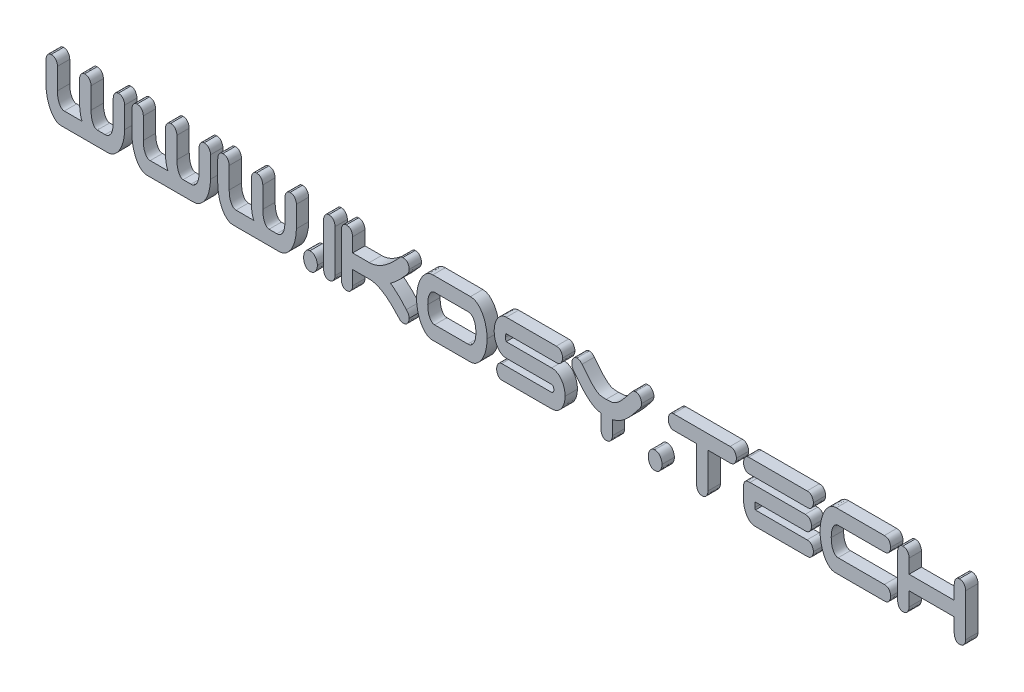
from build123d import *

# Parameters (mm, degrees)
TEXT_EXTRUDE_DEPTH    = 2.5
TEXT_EXTRUDE_2_DEPTH  = 2.5
TEXT_EXTRUDE_3_DEPTH  = 2.5
TEXT_EXTRUDE_4_DEPTH  = 2.5
TEXT_EXTRUDE_5_DEPTH  = 2.5
TEXT_EXTRUDE_6_DEPTH  = 2.5
TEXT_EXTRUDE_7_DEPTH  = 2.5
TEXT_EXTRUDE_8_DEPTH  = 2.5
TEXT_EXTRUDE_9_DEPTH  = 2.5
TEXT_EXTRUDE_10_DEPTH = 2.5
TEXT_EXTRUDE_11_DEPTH = 2.5
TEXT_EXTRUDE_12_DEPTH = 2.5
TEXT_EXTRUDE_13_DEPTH = 2.5
TEXT_EXTRUDE_14_DEPTH = 2.5
TEXT_EXTRUDE_15_DEPTH = 2.5


with BuildPart() as part:
    # Text Sketch → Text Extrude (new body)
    with BuildSketch(Plane.XY):
        with BuildLine():
            add(Edge.make_bspline(
                [(-1.665262476, 9.391283215), (-1.661647435, 9.485939531), (-1.654644135, 9.66931408), (-1.601170871, 9.935788598), (-1.511482213, 10.183634344), (-1.387210661, 10.408902666), (-1.233121899, 10.598793883), (-1.054153918, 10.744631077), (-0.846322218, 10.830852986), (-0.699610858, 10.840002964), (-0.625567077, 10.844620868)],
                knots=[0, 0, 0, 0, 1.147004837, 2.222054497, 3.279664014, 4.331359947, 5.326320678, 6.227132309, 7.105251108, 8, 8, 8, 8], degree=3))
            add(Edge.make_bspline(
                [(-0.625567077, 10.844620868), (-0.52186522, 10.839229926), (-0.325346259, 10.829013884), (-0.049586795, 10.743113534), (0.17785693, 10.588397932), (0.351477364, 10.378612786), (0.480291729, 10.142537388), (0.57961037, 9.897779928), (0.642628094, 9.646609051), (0.649303907, 9.476101408), (0.652624757, 9.391283215)],
                knots=[0, 0, 0, 0, 1.145886374, 2.171498243, 3.151055978, 4.145252637, 5.154343752, 6.11639408, 7.063009444, 8, 8, 8, 8], degree=3))
            Line((0.652624757, 9.391283215), (0.652624757, 5.094620868))
            add(Edge.make_bspline(
                [(0.652624757, 5.094620868), (0.656998695, 4.930565458), (0.665998508, 4.593005117), (0.714729293, 4.085918727), (0.812383062, 3.587666998), (0.977443244, 3.137755853), (1.186044372, 2.761989202), (1.391615293, 2.507933398), (1.580789619, 2.370982482), (1.726577249, 2.299037775), (1.883761548, 2.256535388), (1.991428748, 2.2505978), (2.046338302, 2.247569669)],
                knots=[0, 0, 0, 0, 1.421369808, 2.924609886, 4.408157366, 5.807360525, 7.05526964, 8.123192616, 8.601024659, 9.067825495, 9.524597215, 10, 10, 10, 10], degree=3))
            Line((2.046338302, 2.247569669), (5.679682437, 2.247569669))
            add(Edge.make_bspline(
                [(5.679682437, 2.247569669), (5.636776385, 2.326177759), (5.545400142, 2.493587989), (5.441102799, 2.780216742), (5.347133195, 3.108622744), (5.251720747, 3.610754297), (5.165854345, 4.276960032), (5.15317026, 4.82103053), (5.146791964, 5.094620868)],
                knots=[0, 0, 0, 0, 0.550596351, 1.172595107, 1.872108015, 2.651894347, 4.316377452, 6, 6, 6, 6], degree=3))
            Line((5.146791964, 5.094620868), (5.146791964, 9.391283215))
            add(Edge.make_bspline(
                [(5.146791964, 9.391283215), (5.150407005, 9.485939531), (5.157410304, 9.66931408), (5.210883568, 9.935788598), (5.300572226, 10.183634344), (5.424843778, 10.408902666), (5.578932541, 10.598793883), (5.757900522, 10.744631077), (5.965732221, 10.830852986), (6.112443581, 10.840002964), (6.186487362, 10.844620868)],
                knots=[0, 0, 0, 0, 1.147004837, 2.222054497, 3.279664014, 4.331359947, 5.326320678, 6.227132309, 7.105251108, 8, 8, 8, 8], degree=3))
            add(Edge.make_bspline(
                [(6.186487362, 10.844620868), (6.288940978, 10.839123102), (6.484202286, 10.828645179), (6.758664879, 10.743072245), (6.986457532, 10.588553077), (7.159155664, 10.377536732), (7.293069559, 10.143654548), (7.391420368, 9.897640172), (7.454742512, 9.646643342), (7.461378271, 9.476112799), (7.464679196, 9.391283215)],
                knots=[0, 0, 0, 0, 1.133181501, 2.159674891, 3.140074562, 4.13512574, 5.151897891, 6.114775108, 7.062204094, 8, 8, 8, 8], degree=3))
            Line((7.464679196, 9.391283215), (7.464679196, 5.094620868))
            add(Edge.make_bspline(
                [(7.464679196, 5.094620868), (7.468969063, 4.931807686), (7.477732809, 4.599197491), (7.527176411, 4.099719318), (7.624934527, 3.606174848), (7.753528095, 3.216299997), (7.883740738, 2.933990271), (7.987082153, 2.751801097), (8.095831978, 2.596067703), (8.210563624, 2.467498195), (8.33422143, 2.369076319), (8.464377704, 2.299914121), (8.599855687, 2.257093627), (8.692892003, 2.250732213), (8.739144524, 2.247569669)],
                knots=[0, 0, 0, 0, 1.738006205, 3.550563757, 5.349787416, 7.098028101, 7.916568963, 8.664770571, 9.330559333, 9.940551626, 10.497527359, 11.007556249, 11.506611747, 12, 12, 12, 12], degree=3))
            Line((8.739144524, 2.247569669), (10.326636423, 2.247569669))
            add(Edge.make_bspline(
                [(10.326636423, 2.247569669), (10.403864587, 2.251566188), (10.552470375, 2.259256464), (10.765943266, 2.306390209), (10.954592772, 2.394279474), (11.178150675, 2.553487774), (11.412283373, 2.819497989), (11.633085656, 3.20340022), (11.795835463, 3.650047313), (11.890834764, 4.138402447), (11.945653063, 4.625053437), (11.954619951, 4.944196168), (11.958846403, 5.094620868)],
                knots=[0, 0, 0, 0, 0.636428735, 1.224643805, 1.787762638, 2.338474794, 3.475490099, 4.672300096, 5.970444146, 7.371112152, 8.760900289, 10, 10, 10, 10], degree=3))
            Line((11.958846403, 5.094620868), (11.958846403, 9.391283215))
            add(Edge.make_bspline(
                [(11.958846403, 9.391283215), (11.962461444, 9.485939531), (11.969464744, 9.66931408), (12.022938008, 9.935788598), (12.112626666, 10.183634344), (12.236898218, 10.408902666), (12.39098698, 10.598793883), (12.569954961, 10.744631077), (12.777786661, 10.830852986), (12.924498021, 10.840002964), (12.998541802, 10.844620868)],
                knots=[0, 0, 0, 0, 1.147004837, 2.222054497, 3.279664014, 4.331359947, 5.326320678, 6.227132309, 7.105251108, 8, 8, 8, 8], degree=3))
            add(Edge.make_bspline(
                [(12.998541802, 10.844620868), (13.100995418, 10.839123102), (13.296256725, 10.828645179), (13.570719319, 10.743072245), (13.798511971, 10.588553077), (13.971210104, 10.377536732), (14.105123998, 10.143654548), (14.203474807, 9.897640172), (14.266796951, 9.646643342), (14.27343271, 9.476112799), (14.276733636, 9.391283215)],
                knots=[0, 0, 0, 0, 1.133181501, 2.159674891, 3.140074562, 4.13512574, 5.151897891, 6.114775108, 7.062204094, 8, 8, 8, 8], degree=3))
            Line((14.276733636, 9.391283215), (14.276733636, 5.094620868))
            add(Edge.make_bspline(
                [(14.276733636, 5.094620868), (14.266489461, 4.776023552), (14.245597171, 4.12626621), (14.10735497, 3.319576423), (13.950601674, 2.680075667), (13.810260799, 2.214466993), (13.638495715, 1.773328366), (13.444095749, 1.353366717), (13.226593876, 0.956137232), (12.970625915, 0.58874133), (12.68195493, 0.248538348), (12.366680531, -0.063304026), (12.016603739, -0.333071535), (11.618554403, -0.518825502), (11.184188863, -0.636262779), (10.881430091, -0.648877075), (10.725372651, -0.655379132)],
                knots=[0, 0, 0, 0, 1.799801224, 3.670570972, 4.610410242, 5.520845599, 6.416464605, 7.283311826, 8.134931654, 8.972283627, 9.809105761, 10.653023461, 11.475770373, 12.292173682, 13.11969849, 14, 14, 14, 14], degree=3))
            Line((10.725372651, -0.655379132), (1.479909268, -0.655379132))
            add(Edge.make_bspline(
                [(1.479909268, -0.655379132), (1.352381775, -0.649647021), (1.101506324, -0.638370663), (0.74022145, -0.526787342), (0.4037058, -0.355231111), (0.100696514, -0.109185752), (-0.174017253, 0.18476473), (-0.428519065, 0.515145564), (-0.660617761, 0.879115796), (-0.868605307, 1.276951083), (-1.047671473, 1.706659083), (-1.213373991, 2.155605612), (-1.350319514, 2.628043679), (-1.502744938, 3.278825565), (-1.632617582, 4.103395361), (-1.654486484, 4.76741999), (-1.665262476, 5.094620868)],
                knots=[0, 0, 0, 0, 0.74818093, 1.47184129, 2.203863704, 2.958156395, 3.754085872, 4.566677148, 5.407838898, 6.290259488, 7.203628613, 8.144381123, 9.103901089, 10.094628626, 12.075612124, 14, 14, 14, 14], degree=3))
            Line((-1.665262476, 5.094620868), (-1.665262476, 9.391283215))
        make_face()
    extrude(amount=TEXT_EXTRUDE_DEPTH)


with BuildPart() as body_2:
    # Text Sketch → Text Extrude 2 (new body)
    with BuildSketch(Plane.XY):
        with BuildLine():
            add(Edge.make_bspline(
                [(15.744977317, 9.391283215), (15.748592358, 9.485939531), (15.755595657, 9.66931408), (15.809068922, 9.935788598), (15.89875758, 10.183634344), (16.023029132, 10.408902666), (16.177117894, 10.598793883), (16.356085875, 10.744631077), (16.563917575, 10.830852986), (16.710628935, 10.840002964), (16.784672715, 10.844620868)],
                knots=[0, 0, 0, 0, 1.147004837, 2.222054497, 3.279664014, 4.331359947, 5.326320678, 6.227132309, 7.105251108, 8, 8, 8, 8], degree=3))
            add(Edge.make_bspline(
                [(16.784672715, 10.844620868), (16.888374572, 10.839229926), (17.084893533, 10.829013884), (17.360652998, 10.743113534), (17.588096723, 10.588397932), (17.761717156, 10.378612786), (17.890531521, 10.142537388), (17.989850162, 9.897779928), (18.052867887, 9.646609051), (18.059543699, 9.476101408), (18.06286455, 9.391283215)],
                knots=[0, 0, 0, 0, 1.145886374, 2.171498243, 3.151055978, 4.145252637, 5.154343752, 6.11639408, 7.063009444, 8, 8, 8, 8], degree=3))
            Line((18.06286455, 9.391283215), (18.06286455, 5.094620868))
            add(Edge.make_bspline(
                [(18.06286455, 5.094620868), (18.067238487, 4.930565458), (18.0762383, 4.593005117), (18.124969085, 4.085918727), (18.222622855, 3.587666998), (18.387683036, 3.137755853), (18.596284164, 2.761989202), (18.801855085, 2.507933398), (18.991029411, 2.370982482), (19.136817041, 2.299037775), (19.29400134, 2.256535388), (19.40166854, 2.2505978), (19.456578095, 2.247569669)],
                knots=[0, 0, 0, 0, 1.421369808, 2.924609886, 4.408157366, 5.807360525, 7.05526964, 8.123192616, 8.601024659, 9.067825495, 9.524597215, 10, 10, 10, 10], degree=3))
            Line((19.456578095, 2.247569669), (23.089922229, 2.247569669))
            add(Edge.make_bspline(
                [(23.089922229, 2.247569669), (23.047016178, 2.326177759), (22.955639934, 2.493587989), (22.851342591, 2.780216742), (22.757372988, 3.108622744), (22.66196054, 3.610754297), (22.576094138, 4.276960032), (22.563410053, 4.82103053), (22.557031756, 5.094620868)],
                knots=[0, 0, 0, 0, 0.550596351, 1.172595107, 1.872108015, 2.651894347, 4.316377452, 6, 6, 6, 6], degree=3))
            Line((22.557031756, 5.094620868), (22.557031756, 9.391283215))
            add(Edge.make_bspline(
                [(22.557031756, 9.391283215), (22.560646797, 9.485939531), (22.567650097, 9.66931408), (22.621123361, 9.935788598), (22.710812019, 10.183634344), (22.835083571, 10.408902666), (22.989172333, 10.598793883), (23.168140314, 10.744631077), (23.375972014, 10.830852986), (23.522683374, 10.840002964), (23.596727155, 10.844620868)],
                knots=[0, 0, 0, 0, 1.147004837, 2.222054497, 3.279664014, 4.331359947, 5.326320678, 6.227132309, 7.105251108, 8, 8, 8, 8], degree=3))
            add(Edge.make_bspline(
                [(23.596727155, 10.844620868), (23.699180771, 10.839123102), (23.894442078, 10.828645179), (24.168904672, 10.743072245), (24.396697324, 10.588553077), (24.569395457, 10.377536732), (24.703309351, 10.143654548), (24.801660161, 9.897640172), (24.864982304, 9.646643342), (24.871618063, 9.476112799), (24.874918989, 9.391283215)],
                knots=[0, 0, 0, 0, 1.133181501, 2.159674891, 3.140074562, 4.13512574, 5.151897891, 6.114775108, 7.062204094, 8, 8, 8, 8], degree=3))
            Line((24.874918989, 9.391283215), (24.874918989, 5.094620868))
            add(Edge.make_bspline(
                [(24.874918989, 5.094620868), (24.879208856, 4.931807686), (24.887972601, 4.599197491), (24.937416204, 4.099719318), (25.035174319, 3.606174848), (25.163767888, 3.216299997), (25.293980531, 2.933990271), (25.397321946, 2.751801097), (25.50607177, 2.596067703), (25.620803417, 2.467498195), (25.744461222, 2.369076319), (25.874617496, 2.299914121), (26.010095479, 2.257093627), (26.103131795, 2.250732213), (26.149384316, 2.247569669)],
                knots=[0, 0, 0, 0, 1.738006205, 3.550563757, 5.349787416, 7.098028101, 7.916568963, 8.664770571, 9.330559333, 9.940551626, 10.497527359, 11.007556249, 11.506611747, 12, 12, 12, 12], degree=3))
            Line((26.149384316, 2.247569669), (27.736876215, 2.247569669))
            add(Edge.make_bspline(
                [(27.736876215, 2.247569669), (27.81410438, 2.251566188), (27.962710167, 2.259256464), (28.176183058, 2.306390209), (28.364832565, 2.394279474), (28.588390468, 2.553487774), (28.822523165, 2.819497989), (29.043325448, 3.20340022), (29.206075256, 3.650047313), (29.301074557, 4.138402447), (29.355892855, 4.625053437), (29.364859744, 4.944196168), (29.369086196, 5.094620868)],
                knots=[0, 0, 0, 0, 0.636428735, 1.224643805, 1.787762638, 2.338474794, 3.475490099, 4.672300096, 5.970444146, 7.371112152, 8.760900289, 10, 10, 10, 10], degree=3))
            Line((29.369086196, 5.094620868), (29.369086196, 9.391283215))
            add(Edge.make_bspline(
                [(29.369086196, 9.391283215), (29.372701237, 9.485939531), (29.379704536, 9.66931408), (29.4331778, 9.935788598), (29.522866458, 10.183634344), (29.64713801, 10.408902666), (29.801226773, 10.598793883), (29.980194754, 10.744631077), (30.188026453, 10.830852986), (30.334737813, 10.840002964), (30.408781594, 10.844620868)],
                knots=[0, 0, 0, 0, 1.147004837, 2.222054497, 3.279664014, 4.331359947, 5.326320678, 6.227132309, 7.105251108, 8, 8, 8, 8], degree=3))
            add(Edge.make_bspline(
                [(30.408781594, 10.844620868), (30.51123521, 10.839123102), (30.706496518, 10.828645179), (30.980959111, 10.743072245), (31.208751764, 10.588553077), (31.381449896, 10.377536732), (31.515363791, 10.143654548), (31.6137146, 9.897640172), (31.677036744, 9.646643342), (31.683672503, 9.476112799), (31.686973428, 9.391283215)],
                knots=[0, 0, 0, 0, 1.133181501, 2.159674891, 3.140074562, 4.13512574, 5.151897891, 6.114775108, 7.062204094, 8, 8, 8, 8], degree=3))
            Line((31.686973428, 9.391283215), (31.686973428, 5.094620868))
            add(Edge.make_bspline(
                [(31.686973428, 5.094620868), (31.676729254, 4.776023552), (31.655836964, 4.12626621), (31.517594762, 3.319576423), (31.360841467, 2.680075667), (31.220500592, 2.214466993), (31.048735508, 1.773328366), (30.854335542, 1.353366717), (30.636833669, 0.956137232), (30.380865708, 0.58874133), (30.092194723, 0.248538348), (29.776920324, -0.063304026), (29.426843532, -0.333071535), (29.028794196, -0.518825502), (28.594428656, -0.636262779), (28.291669884, -0.648877075), (28.135612443, -0.655379132)],
                knots=[0, 0, 0, 0, 1.799801224, 3.670570972, 4.610410242, 5.520845599, 6.416464605, 7.283311826, 8.134931654, 8.972283627, 9.809105761, 10.653023461, 11.475770373, 12.292173682, 13.11969849, 14, 14, 14, 14], degree=3))
            Line((28.135612443, -0.655379132), (18.89014906, -0.655379132))
            add(Edge.make_bspline(
                [(18.89014906, -0.655379132), (18.762621568, -0.649647021), (18.511746116, -0.638370663), (18.150461243, -0.526787342), (17.813945592, -0.355231111), (17.510936307, -0.109185752), (17.23622254, 0.18476473), (16.981720728, 0.515145564), (16.749622031, 0.879115796), (16.541634486, 1.276951083), (16.362568319, 1.706659083), (16.196865802, 2.155605612), (16.059920279, 2.628043679), (15.907494854, 3.278825565), (15.777622211, 4.103395361), (15.755753309, 4.76741999), (15.744977317, 5.094620868)],
                knots=[0, 0, 0, 0, 0.74818093, 1.47184129, 2.203863704, 2.958156395, 3.754085872, 4.566677148, 5.407838898, 6.290259488, 7.203628613, 8.144381123, 9.103901089, 10.094628626, 12.075612124, 14, 14, 14, 14], degree=3))
            Line((15.744977317, 5.094620868), (15.744977317, 9.391283215))
        make_face()
    extrude(amount=TEXT_EXTRUDE_2_DEPTH)


with BuildPart() as body_3:
    # Text Sketch → Text Extrude 3 (new body)
    with BuildSketch(Plane.XY):
        with BuildLine():
            add(Edge.make_bspline(
                [(33.15521711, 9.391283215), (33.158832151, 9.485939531), (33.16583545, 9.66931408), (33.219308714, 9.935788598), (33.308997372, 10.183634344), (33.433268924, 10.408902666), (33.587357687, 10.598793883), (33.766325667, 10.744631077), (33.974157367, 10.830852986), (34.120868727, 10.840002964), (34.194912508, 10.844620868)],
                knots=[0, 0, 0, 0, 1.147004837, 2.222054497, 3.279664014, 4.331359947, 5.326320678, 6.227132309, 7.105251108, 8, 8, 8, 8], degree=3))
            add(Edge.make_bspline(
                [(34.194912508, 10.844620868), (34.298614365, 10.839229926), (34.495133326, 10.829013884), (34.77089279, 10.743113534), (34.998336516, 10.588397932), (35.171956949, 10.378612786), (35.300771314, 10.142537388), (35.400089955, 9.897779928), (35.46310768, 9.646609051), (35.469783492, 9.476101408), (35.473104342, 9.391283215)],
                knots=[0, 0, 0, 0, 1.145886374, 2.171498243, 3.151055978, 4.145252637, 5.154343752, 6.11639408, 7.063009444, 8, 8, 8, 8], degree=3))
            Line((35.473104342, 9.391283215), (35.473104342, 5.094620868))
            add(Edge.make_bspline(
                [(35.473104342, 5.094620868), (35.47747828, 4.930565458), (35.486478093, 4.593005117), (35.535208878, 4.085918727), (35.632862647, 3.587666998), (35.797922829, 3.137755853), (36.006523957, 2.761989202), (36.212094878, 2.507933398), (36.401269204, 2.370982482), (36.547056834, 2.299037775), (36.704241133, 2.256535388), (36.811908333, 2.2505978), (36.866817887, 2.247569669)],
                knots=[0, 0, 0, 0, 1.421369808, 2.924609886, 4.408157366, 5.807360525, 7.05526964, 8.123192616, 8.601024659, 9.067825495, 9.524597215, 10, 10, 10, 10], degree=3))
            Line((36.866817887, 2.247569669), (40.500162022, 2.247569669))
            add(Edge.make_bspline(
                [(40.500162022, 2.247569669), (40.45725597, 2.326177759), (40.365879727, 2.493587989), (40.261582384, 2.780216742), (40.167612781, 3.108622744), (40.072200332, 3.610754297), (39.986333931, 4.276960032), (39.973649846, 4.82103053), (39.967271549, 5.094620868)],
                knots=[0, 0, 0, 0, 0.550596351, 1.172595107, 1.872108015, 2.651894347, 4.316377452, 6, 6, 6, 6], degree=3))
            Line((39.967271549, 5.094620868), (39.967271549, 9.391283215))
            add(Edge.make_bspline(
                [(39.967271549, 9.391283215), (39.97088659, 9.485939531), (39.977889889, 9.66931408), (40.031363154, 9.935788598), (40.121051812, 10.183634344), (40.245323364, 10.408902666), (40.399412126, 10.598793883), (40.578380107, 10.744631077), (40.786211807, 10.830852986), (40.932923167, 10.840002964), (41.006966948, 10.844620868)],
                knots=[0, 0, 0, 0, 1.147004837, 2.222054497, 3.279664014, 4.331359947, 5.326320678, 6.227132309, 7.105251108, 8, 8, 8, 8], degree=3))
            add(Edge.make_bspline(
                [(41.006966948, 10.844620868), (41.109420563, 10.839123102), (41.304681871, 10.828645179), (41.579144465, 10.743072245), (41.806937117, 10.588553077), (41.97963525, 10.377536732), (42.113549144, 10.143654548), (42.211899953, 9.897640172), (42.275222097, 9.646643342), (42.281857856, 9.476112799), (42.285158782, 9.391283215)],
                knots=[0, 0, 0, 0, 1.133181501, 2.159674891, 3.140074562, 4.13512574, 5.151897891, 6.114775108, 7.062204094, 8, 8, 8, 8], degree=3))
            Line((42.285158782, 9.391283215), (42.285158782, 5.094620868))
            add(Edge.make_bspline(
                [(42.285158782, 5.094620868), (42.289448648, 4.931807686), (42.298212394, 4.599197491), (42.347655996, 4.099719318), (42.445414112, 3.606174848), (42.57400768, 3.216299997), (42.704220324, 2.933990271), (42.807561739, 2.751801097), (42.916311563, 2.596067703), (43.031043209, 2.467498195), (43.154701015, 2.369076319), (43.284857289, 2.299914121), (43.420335272, 2.257093627), (43.513371588, 2.250732213), (43.559624109, 2.247569669)],
                knots=[0, 0, 0, 0, 1.738006205, 3.550563757, 5.349787416, 7.098028101, 7.916568963, 8.664770571, 9.330559333, 9.940551626, 10.497527359, 11.007556249, 11.506611747, 12, 12, 12, 12], degree=3))
            Line((43.559624109, 2.247569669), (45.147116008, 2.247569669))
            add(Edge.make_bspline(
                [(45.147116008, 2.247569669), (45.224344172, 2.251566188), (45.37294996, 2.259256464), (45.586422851, 2.306390209), (45.775072357, 2.394279474), (45.998630261, 2.553487774), (46.232762958, 2.819497989), (46.453565241, 3.20340022), (46.616315048, 3.650047313), (46.711314349, 4.138402447), (46.766132648, 4.625053437), (46.775099536, 4.944196168), (46.779325988, 5.094620868)],
                knots=[0, 0, 0, 0, 0.636428735, 1.224643805, 1.787762638, 2.338474794, 3.475490099, 4.672300096, 5.970444146, 7.371112152, 8.760900289, 10, 10, 10, 10], degree=3))
            Line((46.779325988, 5.094620868), (46.779325988, 9.391283215))
            add(Edge.make_bspline(
                [(46.779325988, 9.391283215), (46.782941029, 9.485939531), (46.789944329, 9.66931408), (46.843417593, 9.935788598), (46.933106251, 10.183634344), (47.057377803, 10.408902666), (47.211466565, 10.598793883), (47.390434546, 10.744631077), (47.598266246, 10.830852986), (47.744977606, 10.840002964), (47.819021387, 10.844620868)],
                knots=[0, 0, 0, 0, 1.147004837, 2.222054497, 3.279664014, 4.331359947, 5.326320678, 6.227132309, 7.105251108, 8, 8, 8, 8], degree=3))
            add(Edge.make_bspline(
                [(47.819021387, 10.844620868), (47.921475003, 10.839123102), (48.11673631, 10.828645179), (48.391198904, 10.743072245), (48.618991556, 10.588553077), (48.791689689, 10.377536732), (48.925603583, 10.143654548), (49.023954393, 9.897640172), (49.087276537, 9.646643342), (49.093912295, 9.476112799), (49.097213221, 9.391283215)],
                knots=[0, 0, 0, 0, 1.133181501, 2.159674891, 3.140074562, 4.13512574, 5.151897891, 6.114775108, 7.062204094, 8, 8, 8, 8], degree=3))
            Line((49.097213221, 9.391283215), (49.097213221, 5.094620868))
            add(Edge.make_bspline(
                [(49.097213221, 5.094620868), (49.086969046, 4.776023552), (49.066076756, 4.12626621), (48.927834555, 3.319576423), (48.771081259, 2.680075667), (48.630740384, 2.214466993), (48.4589753, 1.773328366), (48.264575334, 1.353366717), (48.047073461, 0.956137232), (47.791105501, 0.58874133), (47.502434515, 0.248538348), (47.187160116, -0.063304026), (46.837083324, -0.333071535), (46.439033988, -0.518825502), (46.004668449, -0.636262779), (45.701909677, -0.648877075), (45.545852236, -0.655379132)],
                knots=[0, 0, 0, 0, 1.799801224, 3.670570972, 4.610410242, 5.520845599, 6.416464605, 7.283311826, 8.134931654, 8.972283627, 9.809105761, 10.653023461, 11.475770373, 12.292173682, 13.11969849, 14, 14, 14, 14], degree=3))
            Line((45.545852236, -0.655379132), (36.300388853, -0.655379132))
            add(Edge.make_bspline(
                [(36.300388853, -0.655379132), (36.172861361, -0.649647021), (35.921985909, -0.638370663), (35.560701036, -0.526787342), (35.224185385, -0.355231111), (34.921176099, -0.109185752), (34.646462333, 0.18476473), (34.391960521, 0.515145564), (34.159861824, 0.879115796), (33.951874278, 1.276951083), (33.772808112, 1.706659083), (33.607105595, 2.155605612), (33.470160071, 2.628043679), (33.317734647, 3.278825565), (33.187862003, 4.103395361), (33.165993101, 4.76741999), (33.15521711, 5.094620868)],
                knots=[0, 0, 0, 0, 0.74818093, 1.47184129, 2.203863704, 2.958156395, 3.754085872, 4.566677148, 5.407838898, 6.290259488, 7.203628613, 8.144381123, 9.103901089, 10.094628626, 12.075612124, 14, 14, 14, 14], degree=3))
            Line((33.15521711, 5.094620868), (33.15521711, 9.391283215))
        make_face()
    extrude(amount=TEXT_EXTRUDE_3_DEPTH)


with BuildPart() as body_4:
    # Text Sketch → Text Extrude 4 (new body)
    with BuildSketch(Plane.XY):
        with BuildLine():
            add(Edge.make_bspline(
                [(50.565456902, 0.797958522), (50.569312687, 0.916360199), (50.576806847, 1.146487485), (50.647756566, 1.478210122), (50.753117191, 1.788479878), (50.909753402, 2.064018691), (51.094419429, 2.301104175), (51.316852984, 2.476485105), (51.570254788, 2.582930712), (51.749513453, 2.59533283), (51.839922229, 2.601587816)],
                knots=[0, 0, 0, 0, 1.160345278, 2.255264598, 3.315503269, 4.363336114, 5.351392794, 6.246249024, 7.115498931, 8, 8, 8, 8], degree=3))
            add(Edge.make_bspline(
                [(51.839922229, 2.601587816), (51.958673818, 2.594408069), (52.186319818, 2.580644542), (52.506464892, 2.476247077), (52.774175357, 2.288369954), (52.982065074, 2.034314334), (53.14582082, 1.747413874), (53.267624257, 1.44155068), (53.34069188, 1.123133089), (53.348818261, 0.906395225), (53.352883992, 0.797958522)],
                knots=[0, 0, 0, 0, 1.081536768, 2.073298739, 3.024956809, 4.020910659, 5.040460596, 6.026519013, 7.012642428, 8, 8, 8, 8], degree=3))
            add(Edge.make_bspline(
                [(53.352883992, 0.797958522), (53.348936746, 0.688258837), (53.341091777, 0.470235823), (53.266905037, 0.149659931), (53.146628748, -0.157940849), (52.983166191, -0.445618392), (52.772832421, -0.696241329), (52.506618415, -0.884190194), (52.186276638, -0.988416412), (51.958659015, -1.002204644), (51.839922229, -1.009397278)],
                knots=[0, 0, 0, 0, 0.997003298, 1.981497619, 2.976448412, 3.994314034, 4.980040474, 5.930126388, 6.92024995, 8, 8, 8, 8], degree=3))
            add(Edge.make_bspline(
                [(51.839922229, -1.009397278), (51.748081661, -1.003597829), (51.568356261, -0.992248725), (51.316911127, -0.881680696), (51.089734641, -0.714502548), (50.905870695, -0.476028838), (50.752924744, -0.198108513), (50.648228962, 0.112879045), (50.576483356, 0.446909235), (50.569215291, 0.678302653), (50.565456902, 0.797958522)],
                knots=[0, 0, 0, 0, 0.89426037, 1.750003366, 2.644842091, 3.630322595, 4.669537068, 5.738481425, 6.830545944, 8, 8, 8, 8], degree=3))
        make_face()
    extrude(amount=TEXT_EXTRUDE_4_DEPTH)


with BuildPart() as body_5:
    # Text Sketch → Text Extrude 5 (new body)
    with BuildSketch(Plane.XY):
        with BuildLine():
            add(Edge.make_bspline(
                [(56.937783539, 0.797958522), (56.934550232, 0.711887332), (56.928097497, 0.540114416), (56.864755808, 0.287752568), (56.765498541, 0.042907575), (56.636449469, -0.192821935), (56.464138103, -0.40334582), (56.234277508, -0.553155291), (55.959994368, -0.640041064), (55.763356374, -0.650081078), (55.659591704, -0.655379132)],
                knots=[0, 0, 0, 0, 0.94997657, 1.895875329, 2.857197367, 3.865524581, 4.858968616, 5.830145621, 6.854981083, 8, 8, 8, 8], degree=3))
            add(Edge.make_bspline(
                [(55.659591704, -0.655379132), (55.584235864, -0.65096414), (55.436140668, -0.642287454), (55.228530073, -0.554957019), (55.047289995, -0.413547378), (54.893797629, -0.224124829), (54.774495883, 0.00294414), (54.683112091, 0.25070549), (54.630951083, 0.518804417), (54.623643504, 0.703334661), (54.619896306, 0.797958522)],
                knots=[0, 0, 0, 0, 0.908202067, 1.784869782, 2.674971349, 3.668287915, 4.711008848, 5.766870674, 6.85489058, 8, 8, 8, 8], degree=3))
            Line((54.619896306, 0.797958522), (54.619896306, 9.391283215))
            add(Edge.make_bspline(
                [(54.619896306, 9.391283215), (54.623511347, 9.485939531), (54.630514646, 9.66931408), (54.683987911, 9.935788598), (54.773676569, 10.183634344), (54.897948121, 10.408902666), (55.052036883, 10.598793883), (55.231004864, 10.744631077), (55.438836564, 10.830852986), (55.585547924, 10.840002964), (55.659591704, 10.844620868)],
                knots=[0, 0, 0, 0, 1.147004837, 2.222054497, 3.279664014, 4.331359947, 5.326320678, 6.227132309, 7.105251108, 8, 8, 8, 8], degree=3))
            add(Edge.make_bspline(
                [(55.659591704, 10.844620868), (55.763293561, 10.839229926), (55.959812522, 10.829013884), (56.235571987, 10.743113534), (56.463015712, 10.588397932), (56.636636145, 10.378612786), (56.76545051, 10.142537388), (56.864769151, 9.897779928), (56.927786876, 9.646609051), (56.934462688, 9.476101408), (56.937783539, 9.391283215)],
                knots=[0, 0, 0, 0, 1.145886374, 2.171498243, 3.151055978, 4.145252637, 5.154343752, 6.11639408, 7.063009444, 8, 8, 8, 8], degree=3))
            Line((56.937783539, 9.391283215), (56.937783539, 0.797958522))
        make_face()
    extrude(amount=TEXT_EXTRUDE_5_DEPTH)


with BuildPart() as body_6:
    # Text Sketch → Text Extrude 6 (new body)
    with BuildSketch(Plane.XY):
        with BuildLine():
            Line((60.500324044, 6.547958522), (63.876539209, 6.547958522))
            add(Edge.make_bspline(
                [(63.876539209, 6.547958522), (64.013352764, 6.552945272), (64.28698551, 6.562918975), (64.696016283, 6.622526416), (65.100282877, 6.730008488), (65.643116703, 6.921863604), (66.314198562, 7.246784237), (67.089343862, 7.739597643), (67.843610376, 8.309325812), (68.557602178, 8.963991813), (69.256802628, 9.664613601), (69.710147851, 10.156148854), (69.939565781, 10.404893065)],
                knots=[0, 0, 0, 0, 0.555923698, 1.111870299, 1.674894669, 2.252652207, 3.448967243, 4.693708672, 5.979538165, 7.28373421, 8.625418241, 10, 10, 10, 10], degree=3))
            add(Edge.make_bspline(
                [(69.939565781, 10.404893065), (69.996719342, 10.472066453), (70.104108377, 10.598282302), (70.293452081, 10.73847091), (70.48836649, 10.829462813), (70.623129599, 10.839664959), (70.688593649, 10.844620868)],
                knots=[0, 0, 0, 0, 1.174655633, 2.207126415, 3.129073488, 4, 4, 4, 4], degree=3))
            add(Edge.make_bspline(
                [(70.688593649, 10.844620868), (70.792295506, 10.839229926), (70.988814467, 10.829013884), (71.264573931, 10.743113534), (71.492017656, 10.588397932), (71.66563809, 10.378612786), (71.794452455, 10.142537388), (71.893771096, 9.897779928), (71.95678882, 9.646609051), (71.963464633, 9.476101408), (71.966785483, 9.391283215)],
                knots=[0, 0, 0, 0, 1.145886374, 2.171498243, 3.151055978, 4.145252637, 5.154343752, 6.11639408, 7.063009444, 8, 8, 8, 8], degree=3))
            add(Edge.make_bspline(
                [(71.966785483, 9.391283215), (71.960175375, 9.277188886), (71.947353213, 9.055870886), (71.828481898, 8.738495446), (71.637309144, 8.437854134), (71.476319208, 8.24890582), (71.389176928, 8.146629942)],
                knots=[0, 0, 0, 0, 0.97070442, 1.882953905, 2.854063618, 4, 4, 4, 4], degree=3))
            add(Edge.make_bspline(
                [(71.389176928, 8.146629942), (71.250565867, 7.984704207), (70.982081064, 7.671059693), (70.585260096, 7.224458373), (70.203189805, 6.817375798), (69.817659662, 6.440945419), (69.403761963, 6.061801999), (69.030275663, 5.743197861), (68.717072193, 5.494553863), (68.505621514, 5.327015044), (68.316009093, 5.197674225), (68.197027473, 5.124073998), (68.143389501, 5.090894362)],
                knots=[0, 0, 0, 0, 1.429198024, 2.76830686, 4.00560822, 5.171790262, 6.380302347, 7.768852966, 8.462165869, 9.061913282, 9.577102168, 10, 10, 10, 10], degree=3))
            add(Edge.make_bspline(
                [(68.143389501, 5.090894362), (68.276777918, 5.006353533), (68.559734718, 4.827017106), (68.966501362, 4.495217289), (69.394827854, 4.133586095), (69.815944987, 3.740265787), (70.227245919, 3.347435173), (70.608165504, 2.933141627), (70.994281524, 2.500795805), (71.255378558, 2.200685644), (71.392903435, 2.042611795)],
                knots=[0, 0, 0, 0, 0.846905687, 1.796540712, 2.813290178, 3.8560258, 4.888565996, 5.86499491, 6.875451368, 8, 8, 8, 8], degree=3))
            add(Edge.make_bspline(
                [(71.392903435, 2.042611795), (71.479286362, 1.94312522), (71.641776613, 1.755986408), (71.826455931, 1.451973267), (71.947683325, 1.13357558), (71.960287666, 0.912122492), (71.966785483, 0.797958522)],
                knots=[0, 0, 0, 0, 1.124204507, 2.114680268, 3.028075944, 4, 4, 4, 4], degree=3))
            add(Edge.make_bspline(
                [(71.966785483, 0.797958522), (71.963552176, 0.711887332), (71.957099441, 0.540114416), (71.893757752, 0.287752568), (71.794500485, 0.042907575), (71.665451413, -0.192821935), (71.493140048, -0.40334582), (71.263279452, -0.553155291), (70.988996312, -0.640041064), (70.792358318, -0.650081078), (70.688593649, -0.655379132)],
                knots=[0, 0, 0, 0, 0.94997657, 1.895875329, 2.857197367, 3.865524581, 4.858968616, 5.830145621, 6.854981083, 8, 8, 8, 8], degree=3))
            add(Edge.make_bspline(
                [(70.688593649, -0.655379132), (70.621742518, -0.650807755), (70.486582523, -0.641565321), (70.293943004, -0.547657424), (70.104156674, -0.414498148), (69.998986248, -0.289368102), (69.943292288, -0.223104342)],
                knots=[0, 0, 0, 0, 0.894537412, 1.808580788, 2.839513922, 4, 4, 4, 4], degree=3))
            add(Edge.make_bspline(
                [(69.943292288, -0.223104342), (69.716363237, 0.024392428), (69.26325026, 0.51857331), (68.560029177, 1.226354593), (67.83951543, 1.891523697), (67.204121537, 2.378116986), (66.687201107, 2.72704405), (66.296809883, 2.957939804), (65.901076878, 3.159667356), (65.502265102, 3.332361249), (65.100167403, 3.470793367), (64.695473166, 3.572963959), (64.287153072, 3.635007937), (64.013387929, 3.641676343), (63.876539209, 3.645009721)],
                knots=[0, 0, 0, 0, 1.63305565, 3.260749131, 4.851847049, 6.398635549, 7.147663603, 7.884382876, 8.603119971, 9.306793234, 9.996529955, 10.669118359, 11.334723743, 12, 12, 12, 12], degree=3))
            Line((63.876539209, 3.645009721), (60.500324044, 3.645009721))
            Line((60.500324044, 3.645009721), (60.500324044, 0.797958522))
            add(Edge.make_bspline(
                [(60.500324044, 0.797958522), (60.497110576, 0.711876438), (60.490697433, 0.540081779), (60.427058175, 0.287883345), (60.328738407, 0.041825046), (60.194707244, -0.191880564), (60.023538588, -0.402196671), (59.797146592, -0.553243329), (59.528706012, -0.639254714), (59.337046012, -0.649850351), (59.237038237, -0.655379132)],
                knots=[0, 0, 0, 0, 0.956995596, 1.909883251, 2.878308143, 3.900938487, 4.901722713, 5.868565532, 6.887822087, 8, 8, 8, 8], degree=3))
            add(Edge.make_bspline(
                [(59.237038237, -0.655379132), (59.161682397, -0.65096414), (59.013587201, -0.642287454), (58.805976605, -0.554957019), (58.624736528, -0.413547378), (58.471244161, -0.224124829), (58.351942415, 0.00294414), (58.260558624, 0.25070549), (58.208397615, 0.518804417), (58.201090036, 0.703334661), (58.197342839, 0.797958522)],
                knots=[0, 0, 0, 0, 0.908202067, 1.784869782, 2.674971349, 3.668287915, 4.711008848, 5.766870674, 6.85489058, 8, 8, 8, 8], degree=3))
            Line((58.197342839, 0.797958522), (58.197342839, 9.391283215))
            add(Edge.make_bspline(
                [(58.197342839, 9.391283215), (58.200951795, 9.485944839), (58.207943306, 9.669329671), (58.261500291, 9.93573116), (58.350880695, 10.18384579), (58.475890186, 10.407448768), (58.625506826, 10.600160474), (58.803421469, 10.742235387), (59.005755918, 10.831670493), (59.14919169, 10.840255293), (59.22213221, 10.844620868)],
                knots=[0, 0, 0, 0, 1.154549111, 2.236669769, 3.301235575, 4.359848899, 5.351786401, 6.258523002, 7.114417303, 8, 8, 8, 8], degree=3))
            add(Edge.make_bspline(
                [(59.22213221, 10.844620868), (59.324585826, 10.839123102), (59.519847133, 10.828645179), (59.794309727, 10.743072245), (60.022102379, 10.588553077), (60.194800512, 10.377536732), (60.328714406, 10.143654548), (60.427065216, 9.897640172), (60.49038736, 9.646643342), (60.497023118, 9.476112799), (60.500324044, 9.391283215)],
                knots=[0, 0, 0, 0, 1.133181501, 2.159674891, 3.140074562, 4.13512574, 5.151897891, 6.114775108, 7.062204094, 8, 8, 8, 8], degree=3))
            Line((60.500324044, 9.391283215), (60.500324044, 6.547958522))
        make_face()
    extrude(amount=TEXT_EXTRUDE_6_DEPTH)


with BuildPart() as body_7:
    # Text Sketch → Text Extrude 7 (new body)
    with BuildSketch(Plane.XY):
        with BuildLine():
            add(Edge.make_bspline(
                [(87.767174336, 5.094620868), (87.756930161, 4.776023552), (87.736037871, 4.12626621), (87.59779567, 3.319576423), (87.441042374, 2.680075667), (87.300701499, 2.214466993), (87.128936415, 1.773328366), (86.934536449, 1.353366717), (86.717034576, 0.956137232), (86.461066615, 0.58874133), (86.17239563, 0.248538348), (85.857121231, -0.063304026), (85.507044439, -0.333071535), (85.108995103, -0.518825502), (84.674629563, -0.636262779), (84.371870791, -0.648877075), (84.215813351, -0.655379132)],
                knots=[0, 0, 0, 0, 1.799801224, 3.670570972, 4.610410242, 5.520845599, 6.416464605, 7.283311826, 8.134931654, 8.972283627, 9.809105761, 10.653023461, 11.475770373, 12.292173682, 13.11969849, 14, 14, 14, 14], degree=3))
            Line((84.215813351, -0.655379132), (76.595106935, -0.655379132))
            add(Edge.make_bspline(
                [(76.595106935, -0.655379132), (76.468544772, -0.640528847), (76.217101845, -0.611025566), (75.85996162, -0.477689644), (75.525367298, -0.289123584), (75.221790344, -0.035897363), (74.944421638, 0.262831556), (74.692827889, 0.59630973), (74.458115204, 0.955244851), (74.256062969, 1.347968886), (74.073540092, 1.765116418), (73.914224495, 2.204851714), (73.775671746, 2.665082269), (73.623533624, 3.302321121), (73.49317431, 4.114435098), (73.471736206, 4.769880754), (73.461114712, 5.094620868)],
                knots=[0, 0, 0, 0, 0.752995526, 1.495987393, 2.241274531, 3.021014421, 3.828493696, 4.653247209, 5.494759435, 6.367584086, 7.267779511, 8.192575619, 9.138386903, 10.115331307, 12.075343481, 14, 14, 14, 14], degree=3))
            add(Edge.make_bspline(
                [(73.461114712, 5.094620868), (73.470905906, 5.425692535), (73.490637982, 6.092897266), (73.631175858, 6.917729294), (73.785276694, 7.567695819), (73.93767825, 8.034668004), (74.101507309, 8.485806188), (74.301681659, 8.908288691), (74.516306703, 9.309536429), (74.769772249, 9.669434187), (75.038023965, 10.002645772), (75.333381057, 10.296581759), (75.654501392, 10.542209403), (76.005682068, 10.717233652), (76.379834315, 10.827060537), (76.639075332, 10.83872074), (76.770252754, 10.844620868)],
                knots=[0, 0, 0, 0, 1.918610406, 3.866552375, 4.837869682, 5.790063797, 6.713181678, 7.618709347, 8.498814124, 9.347956722, 10.166930783, 10.976763261, 11.758994285, 12.499873325, 13.24092741, 14, 14, 14, 14], degree=3))
            Line((76.770252754, 10.844620868), (84.398412184, 10.840894362))
            add(Edge.make_bspline(
                [(84.398412184, 10.840894362), (84.550964093, 10.823819883), (84.847867839, 10.790588723), (85.267446751, 10.65347681), (85.645075165, 10.448575735), (85.974739705, 10.176173964), (86.266617516, 9.861015829), (86.530700866, 9.520084089), (86.773783192, 9.158477927), (86.974999212, 8.763766236), (87.157400004, 8.350547979), (87.320368086, 7.916050503), (87.450708569, 7.457399882), (87.604315844, 6.829888837), (87.734015118, 6.040050569), (87.756264441, 5.405681835), (87.767174336, 5.094620868)],
                knots=[0, 0, 0, 0, 0.886158283, 1.724683192, 2.535023767, 3.357633345, 4.186246996, 5.015639229, 5.850708578, 6.702461068, 7.574344964, 8.463324812, 9.384257606, 10.330630737, 12.200734858, 14, 14, 14, 14], degree=3))
        make_face()
        with BuildLine():
            add(Edge.make_bspline(
                [(83.865521711, 2.247569669), (83.942775401, 2.251509172), (84.091430306, 2.259089735), (84.305671054, 2.307237359), (84.496470048, 2.393196263), (84.720643026, 2.553739022), (84.955007915, 2.81939294), (85.175394878, 3.203486885), (85.339586988, 3.649552177), (85.428442753, 4.13892095), (85.48482297, 4.624994544), (85.493596416, 4.944177302), (85.497731692, 5.094620868)],
                knots=[0, 0, 0, 0, 0.635967372, 1.223756031, 1.795771322, 2.346084253, 3.482275307, 4.678217707, 5.9754207, 7.373017898, 8.761798544, 10, 10, 10, 10], degree=3))
            add(Edge.make_bspline(
                [(85.497731692, 5.094620868), (85.493611897, 5.243829666), (85.484866946, 5.560550262), (85.42801312, 6.044004523), (85.339943952, 6.532486176), (85.173924731, 6.97849454), (84.957114754, 7.367728007), (84.715360939, 7.629694257), (84.494789633, 7.795518686), (84.304645752, 7.882609089), (84.091406658, 7.930052904), (83.942767314, 7.937698676), (83.865521711, 7.941672067)],
                knots=[0, 0, 0, 0, 1.228964797, 2.608683067, 4.007394366, 5.30563143, 6.511373666, 7.655401362, 8.212109266, 8.775268447, 9.363525664, 10, 10, 10, 10], degree=3))
            Line((83.865521711, 7.941672067), (77.120544394, 7.941672067))
            add(Edge.make_bspline(
                [(77.120544394, 7.941672067), (77.066918015, 7.938481781), (76.960578793, 7.932155554), (76.803614714, 7.890875717), (76.658473481, 7.814188686), (76.47229966, 7.673335424), (76.260869058, 7.423523678), (76.057851454, 7.045102046), (75.889172619, 6.597154817), (75.793244983, 6.10067879), (75.743693905, 5.595044353), (75.734864326, 5.258690505), (75.730557356, 5.094620868)],
                knots=[0, 0, 0, 0, 0.465574519, 0.923217892, 1.395730572, 1.880865226, 2.942702673, 4.202393103, 5.594156702, 7.080535221, 8.575917806, 10, 10, 10, 10], degree=3))
            add(Edge.make_bspline(
                [(75.730557356, 5.094620868), (75.734931429, 4.930565735), (75.743931521, 4.593005966), (75.792660132, 4.085915119), (75.890321995, 3.587679987), (76.055354689, 3.137712472), (76.26404241, 2.762123402), (76.469389153, 2.507607863), (76.658055246, 2.37213129), (76.801582198, 2.298159279), (76.958042337, 2.256688656), (77.065660068, 2.250649565), (77.120544394, 2.247569669)],
                knots=[0, 0, 0, 0, 1.42274262, 2.927434583, 4.412414928, 5.81296949, 7.062083882, 8.131038297, 8.609331849, 9.066925166, 9.524138053, 10, 10, 10, 10], degree=3))
            Line((77.120544394, 2.247569669), (83.865521711, 2.247569669))
        make_face(mode=Mode.SUBTRACT)
    extrude(amount=TEXT_EXTRUDE_7_DEPTH)


with BuildPart() as body_8:
    # Text Sketch → Text Extrude 8 (new body)
    with BuildSketch(Plane.XY):
        with BuildLine():
            add(Edge.make_bspline(
                [(91.661373947, 3.645009721), (91.571567661, 3.648255797), (91.395113952, 3.654633769), (91.137683897, 3.71551193), (90.889101497, 3.801667959), (90.658759643, 3.936061141), (90.442147115, 4.096968139), (90.240775256, 4.283094024), (90.058084854, 4.495391392), (89.824899528, 4.805937215), (89.585082893, 5.259022721), (89.365598779, 5.863758315), (89.224787547, 6.535454839), (89.209644102, 7.004379148), (89.201879456, 7.244815295)],
                knots=[0, 0, 0, 0, 0.670943409, 1.318286928, 1.971147206, 2.63301288, 3.304213849, 3.988358664, 4.680103576, 5.397785226, 6.891276586, 8.494040825, 10.202355266, 12, 12, 12, 12], degree=3))
            add(Edge.make_bspline(
                [(89.201879456, 7.244815295), (89.209467352, 7.485281873), (89.224189224, 7.951829942), (89.366053114, 8.619629687), (89.58627831, 9.221541506), (89.826401076, 9.674894554), (90.056659062, 9.991461498), (90.244776957, 10.201511409), (90.445688001, 10.389009342), (90.662376326, 10.550255708), (90.892802008, 10.682185145), (91.138876062, 10.776587502), (91.396636566, 10.833904994), (91.572894355, 10.841039447), (91.661373947, 10.844620868)],
                knots=[0, 0, 0, 0, 1.799259985, 3.490885429, 5.086350142, 6.589356348, 7.315176561, 8.013705268, 8.698464813, 9.370268881, 10.032729266, 10.680721254, 11.337735677, 12, 12, 12, 12], degree=3))
            Line((91.661373947, 10.844620868), (101.793745949, 10.844620868))
            add(Edge.make_bspline(
                [(101.793745949, 10.844620868), (101.897447806, 10.839229926), (102.093966767, 10.829013884), (102.369726232, 10.743113534), (102.597169957, 10.588397932), (102.77079039, 10.378612786), (102.899604755, 10.142537388), (102.998923396, 9.897779928), (103.061941121, 9.646609051), (103.068616933, 9.476101408), (103.071937784, 9.391283215)],
                knots=[0, 0, 0, 0, 1.145886374, 2.171498243, 3.151055978, 4.145252637, 5.154343752, 6.11639408, 7.063009444, 8, 8, 8, 8], degree=3))
            add(Edge.make_bspline(
                [(103.071937784, 9.391283215), (103.068617932, 9.306463546), (103.061944126, 9.135952938), (102.998911148, 8.884804598), (102.899652475, 8.639958538), (102.770603797, 8.404229327), (102.598292327, 8.193705363), (102.368431759, 8.043895913), (102.094148611, 7.957010134), (101.897510618, 7.946970121), (101.793745949, 7.941672067)],
                knots=[0, 0, 0, 0, 0.937886821, 1.885407656, 2.84837822, 3.858434566, 4.853582211, 5.826424641, 6.853017544, 8, 8, 8, 8], degree=3))
            Line((101.793745949, 7.941672067), (91.627835386, 7.941672067))
            add(Edge.make_bspline(
                [(91.627835386, 7.941672067), (91.635253936, 7.940113375), (91.653693207, 7.936239146), (91.64579516, 7.894129667), (91.619807004, 7.851951219), (91.574177234, 7.787070026), (91.522631926, 7.697512353), (91.493086578, 7.571646881), (91.475626456, 7.418056971), (91.472836528, 7.305767972), (91.4713221, 7.244815295)],
                knots=[0, 0, 0, 0, 0.215106107, 0.534659717, 1.070567413, 1.934692608, 3.024957124, 4.391259024, 6.041104441, 8, 8, 8, 8], degree=3))
            add(Edge.make_bspline(
                [(91.4713221, 7.244815295), (91.472240812, 7.1862702), (91.47393013, 7.078618025), (91.498448083, 6.930706292), (91.526934938, 6.806233906), (91.578051458, 6.713805042), (91.623937846, 6.645559692), (91.649497466, 6.599817808), (91.656870998, 6.556221608), (91.636930133, 6.550546746), (91.627835386, 6.547958522)],
                knots=[0, 0, 0, 0, 1.87810599, 3.453443801, 4.819040071, 5.944006706, 6.841177402, 7.412795962, 7.732184537, 8, 8, 8, 8], degree=3))
            Line((91.627835386, 6.547958522), (100.858392741, 6.547958522))
            add(Edge.make_bspline(
                [(100.858392741, 6.547958522), (100.965509985, 6.543434827), (101.176681151, 6.534516805), (101.485057101, 6.470592502), (101.775637638, 6.360373543), (102.045695432, 6.210621407), (102.295396315, 6.032324254), (102.517652387, 5.828696461), (102.722325879, 5.614515872), (102.951547142, 5.293293337), (103.19790109, 4.846421364), (103.407340222, 4.246851601), (103.551353422, 3.598253564), (103.567077445, 3.148924843), (103.575016202, 2.922067401)],
                knots=[0, 0, 0, 0, 0.767417958, 1.512889427, 2.245331768, 2.98632525, 3.720010713, 4.438581646, 5.144019774, 5.838419272, 7.260734989, 8.78409209, 10.376349862, 12, 12, 12, 12], degree=3))
            add(Edge.make_bspline(
                [(103.575016202, 2.922067401), (103.567198037, 2.695209264), (103.55179672, 2.248312307), (103.407755165, 1.604325116), (103.195168583, 1.009637245), (102.950715078, 0.560928669), (102.71411444, 0.243534926), (102.516460192, 0.025293382), (102.290914956, -0.169456604), (102.042267322, -0.339057654), (101.775368991, -0.485581544), (101.483778362, -0.57782008), (101.17847482, -0.648115791), (100.966904282, -0.652916775), (100.858392741, -0.655379132)],
                knots=[0, 0, 0, 0, 1.633240863, 3.217386786, 4.732905502, 6.175788295, 6.879607062, 7.583140963, 8.294100678, 9.021835744, 9.750836772, 10.478571838, 11.21968099, 12, 12, 12, 12], degree=3))
            Line((100.858392741, -0.655379132), (90.740926766, -0.655379132))
            add(Edge.make_bspline(
                [(90.740926766, -0.655379132), (90.666715338, -0.651074809), (90.520826997, -0.642613167), (90.316201206, -0.552747792), (90.132188546, -0.415249199), (89.979664993, -0.222858397), (89.854953079, 0.001743772), (89.764746662, 0.250881452), (89.712205681, 0.518757145), (89.704951291, 0.703318637), (89.701231367, 0.797958522)],
                knots=[0, 0, 0, 0, 0.894345496, 1.758146763, 2.661316177, 3.655828332, 4.707050109, 5.764182805, 6.853512289, 8, 8, 8, 8], degree=3))
            add(Edge.make_bspline(
                [(89.701231367, 0.797958522), (89.704829015, 0.892625502), (89.711798618, 1.076020707), (89.765511195, 1.342348524), (89.85395259, 1.589710365), (89.980638337, 1.812185248), (90.13330605, 2.003371094), (90.31495068, 2.145373661), (90.520966917, 2.234614681), (90.666762516, 2.243201613), (90.740926766, 2.247569669)],
                knots=[0, 0, 0, 0, 1.149184822, 2.22627771, 3.285897309, 4.326438727, 5.32329047, 6.2377172, 7.103550558, 8, 8, 8, 8], degree=3))
            Line((90.740926766, 2.247569669), (100.925469864, 2.247569669))
            add(Edge.make_bspline(
                [(100.925469864, 2.247569669), (100.968540841, 2.259030476), (101.073247736, 2.286892057), (101.191600255, 2.442063856), (101.291407374, 2.655085674), (101.300607583, 2.828476605), (101.305573558, 2.922067401)],
                knots=[0, 0, 0, 0, 0.628525303, 1.527964726, 2.665675604, 4, 4, 4, 4], degree=3))
            add(Edge.make_bspline(
                [(101.305573558, 2.922067401), (101.301538888, 3.022261353), (101.294119201, 3.206516249), (101.185102685, 3.42934075), (101.074270006, 3.599514175), (100.967479012, 3.632165452), (100.925469864, 3.645009721)],
                knots=[0, 0, 0, 0, 1.359030918, 2.499233701, 3.409632674, 4, 4, 4, 4], degree=3))
            Line((100.925469864, 3.645009721), (91.661373947, 3.645009721))
        make_face()
    extrude(amount=TEXT_EXTRUDE_8_DEPTH)


with BuildPart() as body_9:
    # Text Sketch → Text Extrude 9 (new body)
    with BuildSketch(Plane.XY):
        with BuildLine():
            add(Edge.make_bspline(
                [(113.170771225, 0.797958522), (113.167537918, 0.711887332), (113.161085184, 0.540114416), (113.097743494, 0.287752568), (112.998486228, 0.042907575), (112.869437155, -0.192821935), (112.69712579, -0.40334582), (112.467265194, -0.553155291), (112.192982054, -0.640041064), (111.99634406, -0.650081078), (111.892579391, -0.655379132)],
                knots=[0, 0, 0, 0, 0.94997657, 1.895875329, 2.857197367, 3.865524581, 4.858968616, 5.830145621, 6.854981083, 8, 8, 8, 8], degree=3))
            add(Edge.make_bspline(
                [(111.892579391, -0.655379132), (111.81722355, -0.65096414), (111.669128354, -0.642287454), (111.461517759, -0.554957019), (111.280277681, -0.413547378), (111.126785315, -0.224124829), (111.007483569, 0.00294414), (110.916099778, 0.25070549), (110.863938769, 0.518804417), (110.85663119, 0.703334661), (110.852883992, 0.797958522)],
                knots=[0, 0, 0, 0, 0.908202067, 1.784869782, 2.674971349, 3.668287915, 4.711008848, 5.766870674, 6.85489058, 8, 8, 8, 8], degree=3))
            Line((110.852883992, 0.797958522), (110.852883992, 3.645009721))
            add(Edge.make_bspline(
                [(110.852883992, 3.645009721), (110.773087678, 3.647510249), (110.605678932, 3.652756233), (110.344884615, 3.71311442), (110.059944465, 3.79233688), (109.75419775, 3.909109401), (109.434833728, 4.06164328), (109.106492902, 4.253224819), (108.770983832, 4.481855147), (108.428330353, 4.746373937), (108.080154607, 5.051515342), (107.724983243, 5.393837875), (107.358728467, 5.770898364), (106.983773152, 6.187696154), (106.597242638, 6.650253841), (106.181543796, 7.150999813), (105.751481616, 7.705141654), (105.456708407, 8.089347979), (105.30411536, 8.2882372)],
                knots=[0, 0, 0, 0, 0.51394259, 1.078226303, 1.720054327, 2.422657314, 3.18624554, 4.001425141, 4.872820343, 5.804218448, 6.792663798, 7.858349616, 8.986262296, 10.183677807, 11.474644071, 12.875408902, 14.382516238, 16, 16, 16, 16], degree=3))
            add(Edge.make_bspline(
                [(105.30411536, 8.2882372), (105.255196846, 8.364239388), (105.15450155, 8.52068451), (105.032675514, 8.782174619), (104.957688773, 9.077960513), (104.947734567, 9.285269734), (104.9426442, 9.391283215)],
                knots=[0, 0, 0, 0, 0.919132931, 1.89197004, 2.921998782, 4, 4, 4, 4], degree=3))
            add(Edge.make_bspline(
                [(104.9426442, 9.391283215), (104.946259241, 9.485939531), (104.95326254, 9.66931408), (105.006735804, 9.935788598), (105.096424462, 10.183634344), (105.220696014, 10.408902666), (105.374784777, 10.598793883), (105.553752758, 10.744631077), (105.761584457, 10.830852986), (105.908295817, 10.840002964), (105.982339598, 10.844620868)],
                knots=[0, 0, 0, 0, 1.147004837, 2.222054497, 3.279664014, 4.331359947, 5.326320678, 6.227132309, 7.105251108, 8, 8, 8, 8], degree=3))
            add(Edge.make_bspline(
                [(105.982339598, 10.844620868), (106.043382282, 10.843967759), (106.156197466, 10.842760724), (106.312139936, 10.814705212), (106.445401452, 10.777636235), (106.597743941, 10.685933683), (106.78540979, 10.517557879), (106.931387899, 10.36508649), (107.014581983, 10.278191834)],
                knots=[0, 0, 0, 0, 0.892850324, 1.650108851, 2.318058384, 2.90519314, 4.236244996, 6, 6, 6, 6], degree=3))
            add(Edge.make_bspline(
                [(107.014581983, 10.278191834), (107.180406369, 10.061568842), (107.495637026, 9.649770493), (107.951869156, 9.073800746), (108.366796611, 8.570696412), (108.743842836, 8.140051908), (109.087558001, 7.773772997), (109.40653008, 7.472444959), (109.69166375, 7.217929099), (109.959680646, 7.021040292), (110.209287021, 6.870471143), (110.44218163, 6.750962332), (110.666587014, 6.668706186), (110.966933027, 6.595512165), (111.381214847, 6.559384165), (111.722419765, 6.551976406), (111.907485418, 6.547958522)],
                knots=[0, 0, 0, 0, 1.777575934, 3.379155778, 4.787526366, 6.026350324, 7.108430035, 8.058771466, 8.884909664, 9.597223266, 10.221874886, 10.782932193, 11.300185639, 11.775252941, 12.793322593, 14, 14, 14, 14], degree=3))
            add(Edge.make_bspline(
                [(111.907485418, 6.547958522), (112.106222228, 6.552396526), (112.474572523, 6.560622177), (112.923173432, 6.592882002), (113.253880216, 6.663084499), (113.499024559, 6.755575377), (113.754375988, 6.878879402), (114.018862636, 7.044208299), (114.301828088, 7.250281958), (114.598222031, 7.516244134), (114.922198629, 7.828674127), (115.274033566, 8.19942043), (115.653522144, 8.641862386), (116.084830076, 9.150703908), (116.551794838, 9.745325372), (116.875478892, 10.169702455), (117.046338302, 10.393713545)],
                knots=[0, 0, 0, 0, 1.239325888, 2.297038254, 2.796682727, 3.34038997, 3.92556488, 4.561588579, 5.281636894, 6.104623575, 7.040894467, 8.086868039, 9.28857624, 10.673378791, 12.244014403, 14, 14, 14, 14], degree=3))
            add(Edge.make_bspline(
                [(117.046338302, 10.393713545), (117.104968374, 10.461754295), (117.214610173, 10.588994634), (117.403389288, 10.736637181), (117.602094694, 10.823970559), (117.737504455, 10.837901363), (117.802819183, 10.844620868)],
                knots=[0, 0, 0, 0, 1.183013716, 2.212307551, 3.137708786, 4, 4, 4, 4], degree=3))
            add(Edge.make_bspline(
                [(117.802819183, 10.844620868), (117.905272799, 10.839123102), (118.100534107, 10.828645179), (118.3749967, 10.743072245), (118.602789353, 10.588553077), (118.775487486, 10.377536732), (118.90940138, 10.143654548), (119.007752189, 9.897640172), (119.071074333, 9.646643342), (119.077710092, 9.476112799), (119.081011017, 9.391283215)],
                knots=[0, 0, 0, 0, 1.133181501, 2.159674891, 3.140074562, 4.13512574, 5.151897891, 6.114775108, 7.062204094, 8, 8, 8, 8], degree=3))
            add(Edge.make_bspline(
                [(119.081011017, 9.391283215), (119.077022992, 9.300121063), (119.069033214, 9.117482946), (118.99203919, 8.843640746), (118.860935751, 8.561570513), (118.732952984, 8.384261305), (118.663642255, 8.2882372)],
                knots=[0, 0, 0, 0, 0.908745946, 1.820620114, 2.819728521, 4, 4, 4, 4], degree=3))
            add(Edge.make_bspline(
                [(118.663642255, 8.2882372), (118.522178991, 8.104293529), (118.245893779, 7.745041845), (117.83814528, 7.219716306), (117.430882301, 6.735290732), (117.040360649, 6.277709207), (116.657473983, 5.856540867), (116.279783261, 5.471014008), (115.909722336, 5.120964854), (115.54289856, 4.809792994), (115.1814982, 4.536165317), (114.822036227, 4.301344321), (114.468218282, 4.096338015), (114.121169004, 3.939099028), (113.807083062, 3.81341108), (113.542746507, 3.725838537), (113.338780461, 3.66182688), (113.219471018, 3.649884407), (113.170771225, 3.645009721)],
                knots=[0, 0, 0, 0, 1.514965965, 2.958808374, 4.340793673, 5.646109152, 6.88602965, 8.055868939, 9.168841618, 10.210295378, 11.194781138, 12.125953827, 13.012110499, 13.861125281, 14.611060947, 15.218835307, 15.68114377, 16, 16, 16, 16], degree=3))
            Line((113.170771225, 3.645009721), (113.170771225, 0.797958522))
        make_face()
    extrude(amount=TEXT_EXTRUDE_9_DEPTH)


with BuildPart() as body_10:
    # Text Sketch → Text Extrude 10 (new body)
    with BuildSketch(Plane.XY):
        with BuildLine():
            add(Edge.make_bspline(
                [(120.444912508, 0.797958522), (120.448768293, 0.916360199), (120.456262453, 1.146487485), (120.527212172, 1.478210122), (120.632572797, 1.788479878), (120.789209008, 2.064018691), (120.973875035, 2.301104175), (121.19630859, 2.476485105), (121.449710394, 2.582930712), (121.628969059, 2.59533283), (121.719377835, 2.601587816)],
                knots=[0, 0, 0, 0, 1.160345278, 2.255264598, 3.315503269, 4.363336114, 5.351392794, 6.246249024, 7.115498931, 8, 8, 8, 8], degree=3))
            add(Edge.make_bspline(
                [(121.719377835, 2.601587816), (121.838129424, 2.594408069), (122.065775424, 2.580644542), (122.385920498, 2.476247077), (122.653630963, 2.288369954), (122.86152068, 2.034314334), (123.025276426, 1.747413874), (123.147079863, 1.44155068), (123.220147486, 1.123133089), (123.228273867, 0.906395225), (123.232339598, 0.797958522)],
                knots=[0, 0, 0, 0, 1.081536768, 2.073298739, 3.024956809, 4.020910659, 5.040460596, 6.026519013, 7.012642428, 8, 8, 8, 8], degree=3))
            add(Edge.make_bspline(
                [(123.232339598, 0.797958522), (123.228392352, 0.688258837), (123.220547383, 0.470235823), (123.146360643, 0.149659931), (123.026084354, -0.157940849), (122.862621797, -0.445618392), (122.652288027, -0.696241329), (122.386074021, -0.884190194), (122.065732244, -0.988416412), (121.838114621, -1.002204644), (121.719377835, -1.009397278)],
                knots=[0, 0, 0, 0, 0.997003298, 1.981497619, 2.976448412, 3.994314034, 4.980040474, 5.930126388, 6.92024995, 8, 8, 8, 8], degree=3))
            add(Edge.make_bspline(
                [(121.719377835, -1.009397278), (121.627537267, -1.003597829), (121.447811867, -0.992248725), (121.196366733, -0.881680696), (120.969190247, -0.714502548), (120.785326301, -0.476028838), (120.63238035, -0.198108513), (120.527684568, 0.112879045), (120.455938962, 0.446909235), (120.448670897, 0.678302653), (120.444912508, 0.797958522)],
                knots=[0, 0, 0, 0, 0.89426037, 1.750003366, 2.644842091, 3.630322595, 4.669537068, 5.738481425, 6.830545944, 8, 8, 8, 8], degree=3))
        make_face()
    extrude(amount=TEXT_EXTRUDE_10_DEPTH)


with BuildPart() as body_11:
    # Text Sketch → Text Extrude 11 (new body)
    with BuildSketch(Plane.XY):
        with BuildLine():
            add(Edge.make_bspline(
                [(137.024141283, 10.844620868), (137.12784314, 10.839229926), (137.324362101, 10.829013884), (137.600121565, 10.743113534), (137.827565291, 10.588397932), (138.001185724, 10.378612786), (138.130000089, 10.142537388), (138.22931873, 9.897779928), (138.292336455, 9.646609051), (138.299012267, 9.476101408), (138.302333117, 9.391283215)],
                knots=[0, 0, 0, 0, 1.145886374, 2.171498243, 3.151055978, 4.145252637, 5.154343752, 6.11639408, 7.063009444, 8, 8, 8, 8], degree=3))
            add(Edge.make_bspline(
                [(138.302333117, 9.391283215), (138.299013265, 9.306463546), (138.29233946, 9.135952938), (138.229306482, 8.884804598), (138.130047808, 8.639958538), (138.000999131, 8.404229327), (137.82868766, 8.193705363), (137.598827093, 8.043895913), (137.324543945, 7.957010134), (137.127905952, 7.946970121), (137.024141283, 7.941672067)],
                knots=[0, 0, 0, 0, 0.937886821, 1.885407656, 2.84837822, 3.858434566, 4.853582211, 5.826424641, 6.853017544, 8, 8, 8, 8], degree=3))
            Line((137.024141283, 7.941672067), (132.559786131, 7.941672067))
            Line((132.559786131, 7.941672067), (132.559786131, 0.797958522))
            add(Edge.make_bspline(
                [(132.559786131, 0.797958522), (132.556552824, 0.711887332), (132.55010009, 0.540114416), (132.486758401, 0.287752568), (132.387501134, 0.042907575), (132.258452061, -0.192821935), (132.086140696, -0.40334582), (131.8562801, -0.553155291), (131.58199696, -0.640041064), (131.385358966, -0.650081078), (131.281594297, -0.655379132)],
                knots=[0, 0, 0, 0, 0.94997657, 1.895875329, 2.857197367, 3.865524581, 4.858968616, 5.830145621, 6.854981083, 8, 8, 8, 8], degree=3))
            add(Edge.make_bspline(
                [(131.281594297, -0.655379132), (131.207382869, -0.651074809), (131.061494528, -0.642613167), (130.856868737, -0.552747792), (130.672856077, -0.415249199), (130.520332524, -0.222858397), (130.39562061, 0.001743772), (130.305414192, 0.250881452), (130.252873212, 0.518757145), (130.245618822, 0.703318637), (130.241898898, 0.797958522)],
                knots=[0, 0, 0, 0, 0.894345496, 1.758146763, 2.661316177, 3.655828332, 4.707050109, 5.764182805, 6.853512289, 8, 8, 8, 8], degree=3))
            Line((130.241898898, 0.797958522), (130.241898898, 7.941672067))
            Line((130.241898898, 7.941672067), (125.449611147, 7.941672067))
            add(Edge.make_bspline(
                [(125.449611147, 7.941672067), (125.379950208, 7.955273138), (125.241619415, 7.982281775), (125.057520554, 8.090275556), (124.890129375, 8.231693431), (124.753918575, 8.419161159), (124.636715898, 8.632325012), (124.562250055, 8.872326071), (124.50506531, 9.125259625), (124.50128031, 9.301494358), (124.499351912, 9.391283215)],
                knots=[0, 0, 0, 0, 0.897402756, 1.782037934, 2.679022678, 3.672048381, 4.711932852, 5.761986121, 6.859766731, 8, 8, 8, 8], degree=3))
            add(Edge.make_bspline(
                [(124.499351912, 9.391283215), (124.502966953, 9.485939531), (124.509970252, 9.66931408), (124.563443517, 9.935788598), (124.653132175, 10.183634344), (124.777403727, 10.408902666), (124.931492489, 10.598793883), (125.11046047, 10.744631077), (125.31829217, 10.830852986), (125.46500353, 10.840002964), (125.53904731, 10.844620868)],
                knots=[0, 0, 0, 0, 1.147004837, 2.222054497, 3.279664014, 4.331359947, 5.326320678, 6.227132309, 7.105251108, 8, 8, 8, 8], degree=3))
            Line((125.53904731, 10.844620868), (137.024141283, 10.844620868))
        make_face()
    extrude(amount=TEXT_EXTRUDE_11_DEPTH)


with BuildPart() as body_12:
    # Text Sketch → Text Extrude 12 (new body)
    with BuildSketch(Plane.XY):
        with BuildLine():
            add(Edge.make_bspline(
                [(139.763123785, 9.391283215), (139.766738826, 9.485939531), (139.773742125, 9.66931408), (139.82721539, 9.935788598), (139.916904047, 10.183634344), (140.0411756, 10.408902666), (140.195264362, 10.598793883), (140.374232343, 10.744631077), (140.582064042, 10.830852986), (140.728775403, 10.840002964), (140.802819183, 10.844620868)],
                knots=[0, 0, 0, 0, 1.147004837, 2.222054497, 3.279664014, 4.331359947, 5.326320678, 6.227132309, 7.105251108, 8, 8, 8, 8], degree=3))
            Line((140.802819183, 10.844620868), (152.638204796, 10.844620868))
            add(Edge.make_bspline(
                [(152.638204796, 10.844620868), (152.741906653, 10.839229926), (152.938425614, 10.829013884), (153.214185078, 10.743113534), (153.441628803, 10.588397932), (153.615249237, 10.378612786), (153.744063602, 10.142537388), (153.843382243, 9.897779928), (153.906399967, 9.646609051), (153.91307578, 9.476101408), (153.91639663, 9.391283215)],
                knots=[0, 0, 0, 0, 1.145886374, 2.171498243, 3.151055978, 4.145252637, 5.154343752, 6.11639408, 7.063009444, 8, 8, 8, 8], degree=3))
            add(Edge.make_bspline(
                [(153.91639663, 9.391283215), (153.913076778, 9.306463546), (153.906402973, 9.135952938), (153.843369994, 8.884804598), (153.744111321, 8.639958538), (153.615062644, 8.404229327), (153.442751173, 8.193705363), (153.212890606, 8.043895913), (152.938607457, 7.957010134), (152.741969465, 7.946970121), (152.638204796, 7.941672067)],
                knots=[0, 0, 0, 0, 0.937886821, 1.885407656, 2.84837822, 3.858434566, 4.853582211, 5.826424641, 6.853017544, 8, 8, 8, 8], degree=3))
            Line((152.638204796, 7.941672067), (140.802819183, 7.941672067))
            add(Edge.make_bspline(
                [(140.802819183, 7.941672067), (140.72746328, 7.946087047), (140.57936796, 7.954763711), (140.371758276, 8.042094312), (140.190514572, 8.183503291), (140.037037603, 8.37292865), (139.917674062, 8.599986345), (139.82694999, 8.846644326), (139.773814164, 9.113288587), (139.766763352, 9.296639235), (139.763123785, 9.391283215)],
                knots=[0, 0, 0, 0, 0.909879288, 1.788165988, 2.679911349, 3.675062322, 4.719708899, 5.777520637, 6.852775851, 8, 8, 8, 8], degree=3))
        make_face()
    extrude(amount=TEXT_EXTRUDE_12_DEPTH)


with BuildPart() as body_13:
    # Text Sketch → Text Extrude 13 (new body)
    with BuildSketch(Plane.XY):
        with BuildLine():
            add(Edge.make_bspline(
                [(142.040019443, -0.655379132), (141.966543987, -0.651019649), (141.81809935, -0.642212058), (141.59685779, -0.594560513), (141.381542674, -0.504429084), (141.170477791, -0.386829532), (140.971020036, -0.236712261), (140.782029822, -0.064669149), (140.611853574, 0.13548126), (140.391444857, 0.434829379), (140.163419577, 0.875857569), (139.977698135, 1.358652053), (139.864468169, 1.78594525), (139.807651867, 2.136717768), (139.767770665, 2.50875031), (139.76470525, 2.764195993), (139.763123785, 2.895981854)],
                knots=[0, 0, 0, 0, 0.66778488, 1.349145544, 2.042350409, 2.779570347, 3.537462817, 4.303700534, 5.09516923, 5.918537696, 7.674607276, 9.580682945, 10.606481629, 11.681857627, 12.804057347, 14, 14, 14, 14], degree=3))
            Line((139.763123785, 2.895981854), (139.763123785, 5.169151005))
            add(Edge.make_bspline(
                [(139.763123785, 5.169151005), (139.767287169, 5.292397105), (139.774916419, 5.518241112), (139.831560256, 5.828233034), (139.932234888, 6.078011746), (140.086616223, 6.265764051), (140.283029884, 6.392765154), (140.510707936, 6.488857219), (140.779740183, 6.53728), (140.970361661, 6.544265735), (141.071127673, 6.547958522)],
                knots=[0, 0, 0, 0, 1.338978598, 2.453629692, 3.409101363, 4.23361286, 5.049904583, 5.92742182, 6.904397126, 8, 8, 8, 8], degree=3))
            Line((141.071127673, 6.547958522), (152.273007129, 6.547958522))
            add(Edge.make_bspline(
                [(152.273007129, 6.547958522), (152.375460745, 6.542460756), (152.570722052, 6.531982833), (152.845184646, 6.446409899), (153.072977298, 6.291890731), (153.245675431, 6.080874386), (153.379589325, 5.846992202), (153.477940135, 5.600977826), (153.541262279, 5.349980996), (153.547898037, 5.179450453), (153.551198963, 5.094620868)],
                knots=[0, 0, 0, 0, 1.133181501, 2.159674891, 3.140074562, 4.13512574, 5.151897891, 6.114775108, 7.062204094, 8, 8, 8, 8], degree=3))
            add(Edge.make_bspline(
                [(153.551198963, 5.094620868), (153.548160481, 5.008487217), (153.542139263, 4.837800149), (153.476291115, 4.586373161), (153.381741738, 4.339910824), (153.244125531, 4.108167993), (153.074273502, 3.896794383), (152.843840924, 3.747301601), (152.570915569, 3.660712517), (152.37552734, 3.650413576), (152.273007129, 3.645009721)],
                knots=[0, 0, 0, 0, 0.95227599, 1.887081228, 2.863524019, 3.869217818, 4.865066486, 5.838594227, 6.865910305, 8, 8, 8, 8], degree=3))
            Line((152.273007129, 3.645009721), (142.081011017, 3.645009721))
            Line((142.081011017, 3.645009721), (142.081011017, 2.642579391))
            add(Edge.make_bspline(
                [(142.081011017, 2.642579391), (142.084183473, 2.57355255), (142.089338444, 2.461389819), (142.112367895, 2.346474968), (142.183134532, 2.263023015), (142.140143002, 2.252155325), (142.122002592, 2.247569669)],
                knots=[0, 0, 0, 0, 1.857215452, 3.017816741, 3.585564706, 4, 4, 4, 4], degree=3))
            Line((142.122002592, 2.247569669), (152.638204796, 2.247569669))
            add(Edge.make_bspline(
                [(152.638204796, 2.247569669), (152.741910539, 2.242180917), (152.938436865, 2.231969025), (153.214146258, 2.146040462), (153.441768463, 1.991425427), (153.614021699, 1.782102762), (153.745069305, 1.548546984), (153.843227756, 1.304368261), (153.906437874, 1.053305699), (153.913088372, 0.882783805), (153.91639663, 0.797958522)],
                knots=[0, 0, 0, 0, 1.147601261, 2.174748019, 3.155771719, 4.151456253, 5.15008506, 6.113575153, 7.061607182, 8, 8, 8, 8], degree=3))
            add(Edge.make_bspline(
                [(153.91639663, 0.797958522), (153.913163323, 0.711887332), (153.906710589, 0.540114416), (153.8433689, 0.287752568), (153.744111633, 0.042907575), (153.61506256, -0.192821935), (153.442751195, -0.40334582), (153.212890599, -0.553155291), (152.938607459, -0.640041064), (152.741969465, -0.650081078), (152.638204796, -0.655379132)],
                knots=[0, 0, 0, 0, 0.94997657, 1.895875329, 2.857197367, 3.865524581, 4.858968616, 5.830145621, 6.854981083, 8, 8, 8, 8], degree=3))
            Line((152.638204796, -0.655379132), (142.040019443, -0.655379132))
        make_face()
    extrude(amount=TEXT_EXTRUDE_13_DEPTH)


with BuildPart() as body_14:
    # Text Sketch → Text Extrude 14 (new body)
    with BuildSketch(Plane.XY):
        with BuildLine():
            add(Edge.make_bspline(
                [(155.265392093, 5.094620868), (155.275183288, 5.425692535), (155.294915364, 6.092897266), (155.43545324, 6.917729294), (155.589554076, 7.567695819), (155.741955632, 8.034668004), (155.905784691, 8.485806188), (156.10595904, 8.908288691), (156.320584085, 9.309536429), (156.574049631, 9.669434187), (156.842301347, 10.002645772), (157.137658439, 10.296581759), (157.458778773, 10.542209403), (157.809959449, 10.717233652), (158.184111697, 10.827060537), (158.443352714, 10.83872074), (158.574530136, 10.844620868)],
                knots=[0, 0, 0, 0, 1.918610406, 3.866552375, 4.837869682, 5.790063797, 6.713181678, 7.618709347, 8.498814124, 9.347956722, 10.166930783, 10.976763261, 11.758994285, 12.499873325, 13.24092741, 14, 14, 14, 14], degree=3))
            Line((158.574530136, 10.844620868), (168.308165911, 10.844620868))
            add(Edge.make_bspline(
                [(168.308165911, 10.844620868), (168.411867767, 10.839229926), (168.608386728, 10.829013884), (168.884146193, 10.743113534), (169.111589918, 10.588397932), (169.285210352, 10.378612786), (169.414024716, 10.142537388), (169.513343357, 9.897779928), (169.576361082, 9.646609051), (169.583036894, 9.476101408), (169.586357745, 9.391283215)],
                knots=[0, 0, 0, 0, 1.145886374, 2.171498243, 3.151055978, 4.145252637, 5.154343752, 6.11639408, 7.063009444, 8, 8, 8, 8], degree=3))
            add(Edge.make_bspline(
                [(169.586357745, 9.391283215), (169.583037893, 9.306463546), (169.576364088, 9.135952938), (169.513331109, 8.884804598), (169.414072436, 8.639958538), (169.285023759, 8.404229327), (169.112712288, 8.193705363), (168.88285172, 8.043895913), (168.608568572, 7.957010134), (168.41193058, 7.946970121), (168.308165911, 7.941672067)],
                knots=[0, 0, 0, 0, 0.937886821, 1.885407656, 2.84837822, 3.858434566, 4.853582211, 5.826424641, 6.853017544, 8, 8, 8, 8], degree=3))
            Line((168.308165911, 7.941672067), (158.924821776, 7.941672067))
            add(Edge.make_bspline(
                [(158.924821776, 7.941672067), (158.871195397, 7.938481781), (158.764856175, 7.932155554), (158.607892096, 7.890875717), (158.462750863, 7.814188686), (158.276577041, 7.673335424), (158.06514644, 7.423523678), (157.862128836, 7.045102046), (157.693450001, 6.597154817), (157.597522365, 6.10067879), (157.547971287, 5.595044353), (157.539141707, 5.258690505), (157.534834738, 5.094620868)],
                knots=[0, 0, 0, 0, 0.465574519, 0.923217892, 1.395730572, 1.880865226, 2.942702673, 4.202393103, 5.594156702, 7.080535221, 8.575917806, 10, 10, 10, 10], degree=3))
            add(Edge.make_bspline(
                [(157.534834738, 5.094620868), (157.539208811, 4.930565735), (157.548208902, 4.593005966), (157.596937514, 4.085915119), (157.694599376, 3.587679987), (157.859632071, 3.137712472), (158.068319792, 2.762123402), (158.273666535, 2.507607863), (158.462332628, 2.37213129), (158.60585958, 2.298159279), (158.762319719, 2.256688656), (158.86993745, 2.250649565), (158.924821776, 2.247569669)],
                knots=[0, 0, 0, 0, 1.42274262, 2.927434583, 4.412414928, 5.81296949, 7.062083882, 8.131038297, 8.609331849, 9.066925166, 9.524138053, 10, 10, 10, 10], degree=3))
            Line((158.924821776, 2.247569669), (168.308165911, 2.247569669))
            add(Edge.make_bspline(
                [(168.308165911, 2.247569669), (168.411871654, 2.242180917), (168.60839798, 2.231969025), (168.884107373, 2.146040462), (169.111729577, 1.991425427), (169.283982814, 1.782102762), (169.41503042, 1.548546984), (169.51318887, 1.304368261), (169.576398988, 1.053305699), (169.583049487, 0.882783805), (169.586357745, 0.797958522)],
                knots=[0, 0, 0, 0, 1.147601261, 2.174748019, 3.155771719, 4.151456253, 5.15008506, 6.113575153, 7.061607182, 8, 8, 8, 8], degree=3))
            add(Edge.make_bspline(
                [(169.586357745, 0.797958522), (169.583124438, 0.711887332), (169.576671703, 0.540114416), (169.513330014, 0.287752568), (169.414072747, 0.042907575), (169.285023675, -0.192821935), (169.112712309, -0.40334582), (168.882851714, -0.553155291), (168.608568574, -0.640041064), (168.41193058, -0.650081078), (168.308165911, -0.655379132)],
                knots=[0, 0, 0, 0, 0.94997657, 1.895875329, 2.857197367, 3.865524581, 4.858968616, 5.830145621, 6.854981083, 8, 8, 8, 8], degree=3))
            Line((168.308165911, -0.655379132), (158.410563837, -0.655379132))
            add(Edge.make_bspline(
                [(158.410563837, -0.655379132), (158.283036344, -0.649647021), (158.032160893, -0.638370663), (157.670876019, -0.526787342), (157.334360369, -0.355231111), (157.031351083, -0.109185752), (156.756637316, 0.18476473), (156.502135504, 0.515145564), (156.270036808, 0.879115796), (156.062049262, 1.276951083), (155.882983096, 1.706659083), (155.717280579, 2.155605612), (155.580335055, 2.628043679), (155.427909631, 3.278825565), (155.298036987, 4.103395361), (155.276168085, 4.76741999), (155.265392093, 5.094620868)],
                knots=[0, 0, 0, 0, 0.74818093, 1.47184129, 2.203863704, 2.958156395, 3.754085872, 4.566677148, 5.407838898, 6.290259488, 7.203628613, 8.144381123, 9.103901089, 10.094628626, 12.075612124, 14, 14, 14, 14], degree=3))
        make_face()
    extrude(amount=TEXT_EXTRUDE_14_DEPTH)


with BuildPart() as body_15:
    # Text Sketch → Text Extrude 15 (new body)
    with BuildSketch(Plane.XY):
        with BuildLine():
            add(Edge.make_bspline(
                [(184.794232016, 0.797958522), (184.791019063, 0.711875695), (184.78460695, 0.540079554), (184.720959955, 0.287892261), (184.622670585, 0.041790192), (184.488520121, -0.191743633), (184.317130287, -0.403499492), (184.086923258, -0.553113807), (183.813934491, -0.639668722), (183.61855553, -0.649972657), (183.516040181, -0.655379132)],
                knots=[0, 0, 0, 0, 0.950792463, 1.897503612, 2.859651287, 3.875653062, 4.869950321, 5.841961427, 6.867677075, 8, 8, 8, 8], degree=3))
            add(Edge.make_bspline(
                [(183.516040181, -0.655379132), (183.440684341, -0.65096414), (183.292589145, -0.642287454), (183.08497855, -0.554957019), (182.903738472, -0.413547378), (182.750246106, -0.224124829), (182.63094436, 0.00294414), (182.539560568, 0.25070549), (182.48739956, 0.518804417), (182.480091981, 0.703334661), (182.476344783, 0.797958522)],
                knots=[0, 0, 0, 0, 0.908202067, 1.784869782, 2.674971349, 3.668287915, 4.711008848, 5.766870674, 6.85489058, 8, 8, 8, 8], degree=3))
            Line((182.476344783, 0.797958522), (182.476344783, 3.645009721))
            Line((182.476344783, 3.645009721), (173.32404407, 3.645009721))
            Line((173.32404407, 3.645009721), (173.32404407, 0.797958522))
            add(Edge.make_bspline(
                [(173.32404407, 0.797958522), (173.320810763, 0.711887332), (173.314358029, 0.540114416), (173.25101634, 0.287752568), (173.151759073, 0.042907575), (173.02271, -0.192821935), (172.850398635, -0.40334582), (172.62053804, -0.553155291), (172.346254899, -0.640041064), (172.149616905, -0.650081078), (172.045852236, -0.655379132)],
                knots=[0, 0, 0, 0, 0.94997657, 1.895875329, 2.857197367, 3.865524581, 4.858968616, 5.830145621, 6.854981083, 8, 8, 8, 8], degree=3))
            add(Edge.make_bspline(
                [(172.045852236, -0.655379132), (171.970496395, -0.65096414), (171.8224012, -0.642287454), (171.614790604, -0.554957019), (171.433550526, -0.413547378), (171.28005816, -0.224124829), (171.160756414, 0.00294414), (171.069372623, 0.25070549), (171.017211614, 0.518804417), (171.009904035, 0.703334661), (171.006156837, 0.797958522)],
                knots=[0, 0, 0, 0, 0.908202067, 1.784869782, 2.674971349, 3.668287915, 4.711008848, 5.766870674, 6.85489058, 8, 8, 8, 8], degree=3))
            Line((171.006156837, 0.797958522), (171.006156837, 9.391283215))
            add(Edge.make_bspline(
                [(171.006156837, 9.391283215), (171.009771878, 9.485939531), (171.016775178, 9.66931408), (171.070248442, 9.935788598), (171.1599371, 10.183634344), (171.284208652, 10.408902666), (171.438297414, 10.598793883), (171.617265395, 10.744631077), (171.825097095, 10.830852986), (171.971808455, 10.840002964), (172.045852236, 10.844620868)],
                knots=[0, 0, 0, 0, 1.147004837, 2.222054497, 3.279664014, 4.331359947, 5.326320678, 6.227132309, 7.105251108, 8, 8, 8, 8], degree=3))
            add(Edge.make_bspline(
                [(172.045852236, 10.844620868), (172.149554093, 10.839229926), (172.346073054, 10.829013884), (172.621832518, 10.743113534), (172.849276243, 10.588397932), (173.022896677, 10.378612786), (173.151711042, 10.142537388), (173.251029683, 9.897779928), (173.314047408, 9.646609051), (173.32072322, 9.476101408), (173.32404407, 9.391283215)],
                knots=[0, 0, 0, 0, 1.145886374, 2.171498243, 3.151055978, 4.145252637, 5.154343752, 6.11639408, 7.063009444, 8, 8, 8, 8], degree=3))
            Line((173.32404407, 9.391283215), (173.32404407, 6.547958522))
            Line((173.32404407, 6.547958522), (182.476344783, 6.547958522))
            Line((182.476344783, 6.547958522), (182.476344783, 9.391283215))
            add(Edge.make_bspline(
                [(182.476344783, 9.391283215), (182.479959824, 9.485939531), (182.486963123, 9.66931408), (182.540436388, 9.935788598), (182.630125046, 10.183634344), (182.754396598, 10.408902666), (182.90848536, 10.598793883), (183.087453341, 10.744631077), (183.295285041, 10.830852986), (183.441996401, 10.840002964), (183.516040181, 10.844620868)],
                knots=[0, 0, 0, 0, 1.147004837, 2.222054497, 3.279664014, 4.331359947, 5.326320678, 6.227132309, 7.105251108, 8, 8, 8, 8], degree=3))
            add(Edge.make_bspline(
                [(183.516040181, 10.844620868), (183.618493797, 10.839123102), (183.813755105, 10.828645179), (184.088217699, 10.743072245), (184.316010351, 10.588553077), (184.488708484, 10.377536732), (184.622622378, 10.143654548), (184.720973187, 9.897640172), (184.784295331, 9.646643342), (184.79093109, 9.476112799), (184.794232016, 9.391283215)],
                knots=[0, 0, 0, 0, 1.133181501, 2.159674891, 3.140074562, 4.13512574, 5.151897891, 6.114775108, 7.062204094, 8, 8, 8, 8], degree=3))
            Line((184.794232016, 9.391283215), (184.794232016, 0.797958522))
        make_face()
    extrude(amount=TEXT_EXTRUDE_15_DEPTH)


solid = Compound([part.part, body_2.part, body_3.part, body_4.part, body_5.part, body_6.part, body_7.part, body_8.part, body_9.part, body_10.part, body_11.part, body_12.part, body_13.part, body_14.part, body_15.part])
